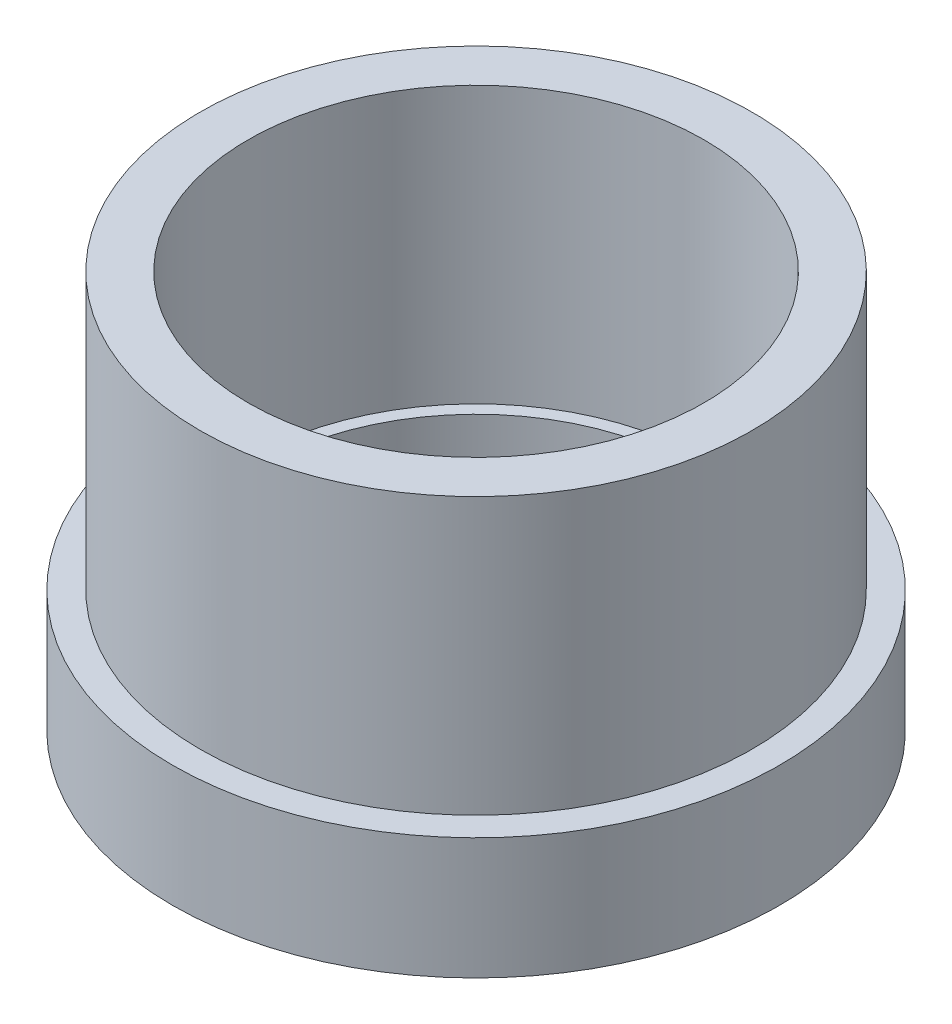
from build123d import *

# Parameters (mm, degrees)
SKETCH4_R           = 50
SKETCH4_R_2         = 41.3
BOSS_EXTRUDE1_DEPTH = 50
SKETCH3_R           = 1.6
CUT_EXTRUDE1_DEPTH  = 10


with BuildPart() as part:
    # Sketch1 → Revolve1 (revolve)
    with BuildSketch(Plane.XY, mode=Mode.PRIVATE) as revolve1_sk:
        Polygon((39, 0), (39, 10), (55, 10), (55, -12), (41.5, -12), (41.5, 0), align=None)
    revolve(revolve1_sk.sketch.rotate(Axis((0, 83.520836207, 0), (0, -1, 0)), 90), axis=Axis((0, 83.520836207, 0), (0, -1, 0)))

    # Sketch4 → Boss-Extrude1 (add)
    with BuildSketch(Plane(origin=(0, 10, 0), x_dir=(1, 0, 0), z_dir=(0, 1, 0))):
        with Locations(Location((0, 0, 0), (0, 0, 270))):
            Circle(SKETCH4_R)
        with Locations(Location((0, 0, 0), (0, 0, 270))):
            Circle(SKETCH4_R_2, mode=Mode.SUBTRACT)
    extrude(amount=BOSS_EXTRUDE1_DEPTH)

    # Sketch3 → Cut-Extrude1 (cut)
    with BuildSketch(Plane.XZ.offset(12)):
        with Locations(Location((0, 48.25, 0), (0, 0, 270))):
            Circle(SKETCH3_R)
        with Locations(Location((48.25, 0, 0), (0, 0, 270))):
            Circle(SKETCH3_R)
        with Locations(Location((0, -48.25, 0), (0, 0, 270))):
            Circle(SKETCH3_R)
        with Locations(Location((-48.25, 0, 0), (0, 0, 270))):
            Circle(SKETCH3_R)
    extrude(amount=-CUT_EXTRUDE1_DEPTH, mode=Mode.SUBTRACT)


solid = part.part
